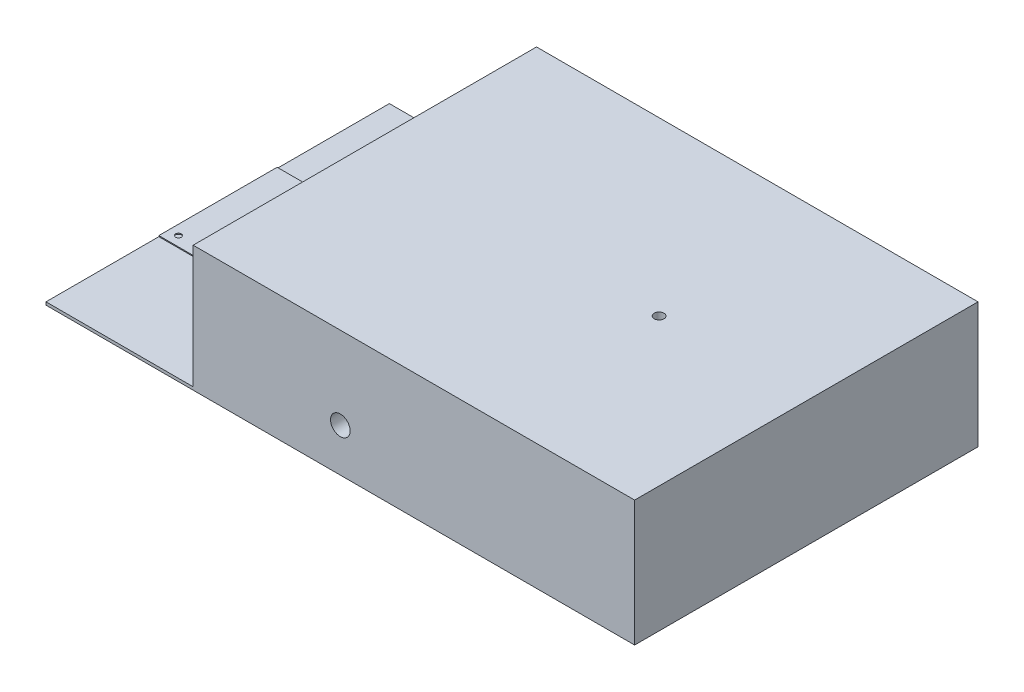
from build123d import *

# Parameters (mm, degrees)
SKETCH2_W           = 600
SKETCH2_H           = 350
BOSS_EXTRUDE1_DEPTH = 3
SKETCH3_W           = 450
SKETCH3_H           = 350
BOSS_EXTRUDE2_DEPTH = 125
SKETCH4_R           = 10
CUT_EXTRUDE1_DEPTH  = 350
SKETCH6_R           = 5
CUT_EXTRUDE2_DEPTH  = 20
SKETCH7_W           = 120
SKETCH7_H           = 120.57779395
SKETCH7_R           = 3
BOSS_EXTRUDE3_DEPTH = 1


with BuildPart() as part:
    # Sketch2 → Boss-Extrude1 (new body)
    with BuildSketch(Plane(origin=(0, 0, 0), x_dir=(1, 0, 0), z_dir=(0, 1, 0))):
        Rectangle(SKETCH2_W, SKETCH2_H)
    extrude(amount=BOSS_EXTRUDE1_DEPTH)

    # Sketch3 → Boss-Extrude2 (add)
    with BuildSketch(Plane(origin=(0, 3, 0), x_dir=(1, 0, 0), z_dir=(0, 1, 0))):
        with Locations((75, 0)):
            Rectangle(SKETCH3_W, SKETCH3_H)
    extrude(amount=BOSS_EXTRUDE2_DEPTH)

    # Sketch4 → Cut-Extrude1 (cut)
    with BuildSketch(Plane.XY.offset(175)):
        with Locations((0, 44)):
            Circle(SKETCH4_R)
    extrude(amount=-CUT_EXTRUDE1_DEPTH, mode=Mode.SUBTRACT)

    # Sketch6 → Cut-Extrude2 (cut)
    with BuildSketch(Plane(origin=(0, 128, 0), x_dir=(1, 0, 0), z_dir=(0, 1, 0))):
        with Locations(Location((150, 0, 0), (0, 0, 270))):
            Circle(SKETCH6_R)
    extrude(amount=-CUT_EXTRUDE2_DEPTH, mode=Mode.SUBTRACT)

    # Sketch7 → Boss-Extrude3 (add, symmetric)
    with BuildSketch(Plane(origin=(0, 3, 0), x_dir=(1, 0, 0), z_dir=(0, 1, 0))):
        with Locations((-240, 0.288896975)):
            Rectangle(SKETCH7_W, SKETCH7_H)
        with Locations(Location((-190, 50.57779395, 0), (0, 0, 270))):
            Circle(SKETCH7_R, mode=Mode.SUBTRACT)
        with Locations(Location((-290, -50, 0), (0, 0, 270))):
            Circle(SKETCH7_R, mode=Mode.SUBTRACT)
    extrude(amount=BOSS_EXTRUDE3_DEPTH, both=True)


solid = part.part
